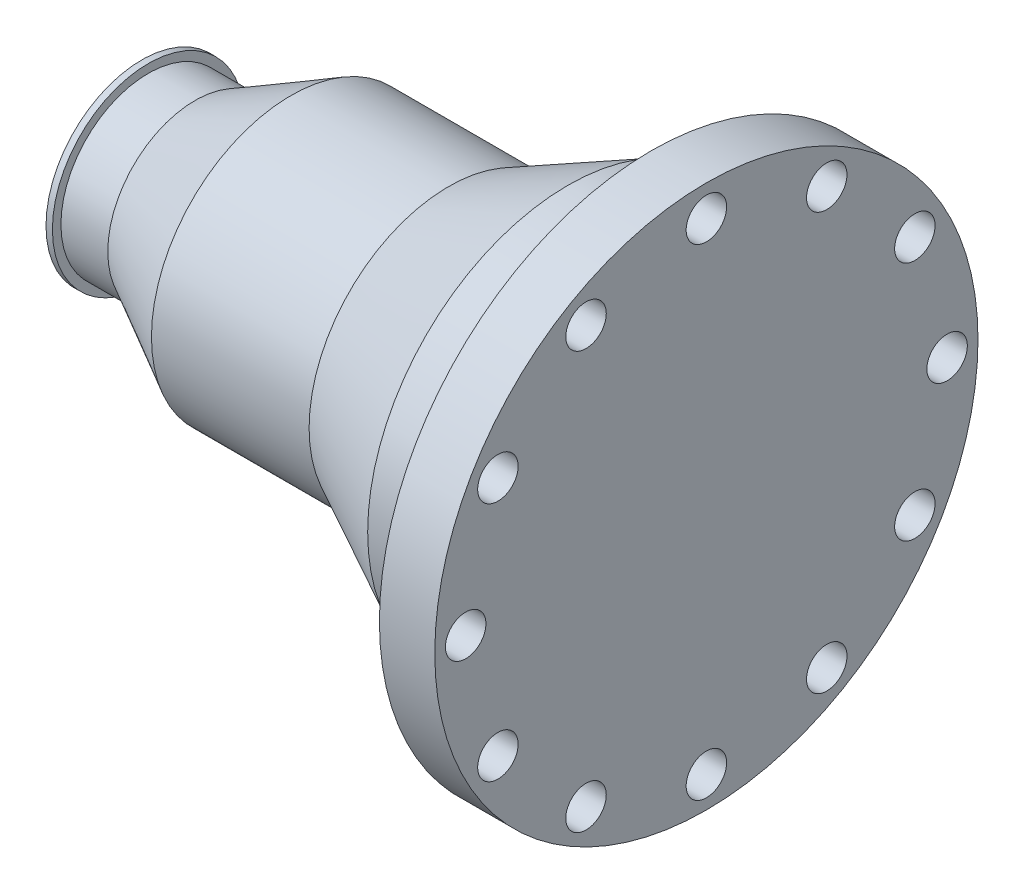
from build123d import *

# Parameters (mm, degrees)
SKETCH_3_R           = 9.5
CUT_EXTRUDE_1_DEPTH  = 321.526909947
SKETCH_4_R           = 9.5
CUT_EXTRUDE_2_DEPTH  = 321.526909947
SKETCH_5_R           = 9.5
CUT_EXTRUDE_3_DEPTH  = 321.526909947
SKETCH_6_R           = 9.5
CUT_EXTRUDE_4_DEPTH  = 321.526909947
SKETCH_7_R           = 9.5
CUT_EXTRUDE_5_DEPTH  = 321.526909947
SKETCH_8_R           = 9.5
CUT_EXTRUDE_6_DEPTH  = 321.526909947
SKETCH_9_R           = 9.5
CUT_EXTRUDE_7_DEPTH  = 321.526909947
SKETCH_10_R          = 9.5
CUT_EXTRUDE_8_DEPTH  = 321.526909947
SKETCH_11_R          = 9.5
CUT_EXTRUDE_9_DEPTH  = 321.526909947
SKETCH_12_R          = 9.5
CUT_EXTRUDE_10_DEPTH = 321.526909947
SKETCH_13_R          = 9.5
CUT_EXTRUDE_11_DEPTH = 321.526909947
SKETCH_14_R          = 9.5
CUT_EXTRUDE_12_DEPTH = 321.526909947


with BuildPart() as part:
    # Эскиз1 → Повернуть1 (revolve)
    with BuildSketch(Plane.XY, mode=Mode.PRIVATE) as revolve_1_sk:
        Polygon((0, 0), (265, 0), (265, 127.5), (239, 127.5), (239, 100), (239, 95), (220, 95), (220, 94), (200, 94), (144, 65.5), (70, 65.5), (25, 41), (3, 41), (3, 45), (0, 45), align=None)
    revolve(revolve_1_sk.sketch.rotate(Axis((0, 0, 0), (1, 0, 0)), 90), axis=Axis((0, 0, 0), (1, 0, 0)))

    # Эскиз2 → Вырез-Повернуть1 (revolve, cut)
    with BuildSketch(Plane.XY, mode=Mode.PRIVATE) as cut_revolve_1_sk:
        with BuildLine():
            Line((0, 0), (257, 0))
            Line((257, 0), (257, 34))
            Line((257, 34), (239, 34))
            Line((239, 34), (239, 47))
            Line((239, 47), (220, 47))
            Line((220, 47), (220, 38.502577))
            Line((220, 38.502577), (200, 38.502577))
            Line((200, 38.502577), (200, 55))
            Line((200, 55), (147.669872, 55))
            ThreePointArc((147.669872, 55), (146.273624348, 54.108499061), (146.669872, 52.5))
            Line((146.669872, 52.5), (143.5, 52.5))
            ThreePointArc((143.5, 52.5), (142.75, 52.602347572), (142, 52.5))
            Line((142, 52.5), (90, 52.5))
            ThreePointArc((90, 52.5), (79.13262933, 46.740617582), (70, 38.502577))
            Line((70, 38.502577), (42, 31))
            Line((42, 31), (0, 31))
            Line((0, 31), (0, 0))
        make_face()
    revolve(cut_revolve_1_sk.sketch.rotate(Axis((0, 0, 0), (1, 0, 0)), 90), axis=Axis((0, 0, 0), (1, 0, 0)), mode=Mode.SUBTRACT)

    # Эскиз3 → Вырез-Вытянуть1 (cut, through all)
    with BuildSketch(Plane(origin=(0, 0, 0), x_dir=(0, 0, -1), z_dir=(1, 0, 0))):
        with Locations((0, 113)):
            Circle(SKETCH_3_R)
    extrude(amount=CUT_EXTRUDE_1_DEPTH, mode=Mode.SUBTRACT)

    # Эскиз4 → Вырез-Вытянуть2 (cut, through all)
    with BuildSketch(Plane(origin=(0, 0, 0), x_dir=(0, 0, -1), z_dir=(1, 0, 0))):
        with Locations((-56.5, 97.860870628)):
            Circle(SKETCH_4_R)
    extrude(amount=CUT_EXTRUDE_2_DEPTH, mode=Mode.SUBTRACT)

    # Эскиз5 → Вырез-Вытянуть3 (cut, through all)
    with BuildSketch(Plane(origin=(0, 0, 0), x_dir=(0, 0, -1), z_dir=(1, 0, 0))):
        with Locations((-97.860870628, 56.5)):
            Circle(SKETCH_5_R)
    extrude(amount=CUT_EXTRUDE_3_DEPTH, mode=Mode.SUBTRACT)

    # Эскиз6 → Вырез-Вытянуть4 (cut, through all)
    with BuildSketch(Plane(origin=(0, 0, 0), x_dir=(0, 0, -1), z_dir=(1, 0, 0))):
        with Locations((-113, 0)):
            Circle(SKETCH_6_R)
    extrude(amount=CUT_EXTRUDE_4_DEPTH, mode=Mode.SUBTRACT)

    # Эскиз7 → Вырез-Вытянуть5 (cut, through all)
    with BuildSketch(Plane(origin=(0, 0, 0), x_dir=(0, 0, -1), z_dir=(1, 0, 0))):
        with Locations((-97.860870628, -56.5)):
            Circle(SKETCH_7_R)
    extrude(amount=CUT_EXTRUDE_5_DEPTH, mode=Mode.SUBTRACT)

    # Эскиз8 → Вырез-Вытянуть6 (cut, through all)
    with BuildSketch(Plane(origin=(0, 0, 0), x_dir=(0, 0, -1), z_dir=(1, 0, 0))):
        with Locations((-56.5, -97.860870628)):
            Circle(SKETCH_8_R)
    extrude(amount=CUT_EXTRUDE_6_DEPTH, mode=Mode.SUBTRACT)

    # Эскиз9 → Вырез-Вытянуть7 (cut, through all)
    with BuildSketch(Plane(origin=(0, 0, 0), x_dir=(0, 0, -1), z_dir=(1, 0, 0))):
        with Locations((0, -113)):
            Circle(SKETCH_9_R)
    extrude(amount=CUT_EXTRUDE_7_DEPTH, mode=Mode.SUBTRACT)

    # Эскиз10 → Вырез-Вытянуть8 (cut, through all)
    with BuildSketch(Plane(origin=(0, 0, 0), x_dir=(0, 0, -1), z_dir=(1, 0, 0))):
        with Locations((56.5, -97.860870628)):
            Circle(SKETCH_10_R)
    extrude(amount=CUT_EXTRUDE_8_DEPTH, mode=Mode.SUBTRACT)

    # Эскиз11 → Вырез-Вытянуть9 (cut, through all)
    with BuildSketch(Plane(origin=(0, 0, 0), x_dir=(0, 0, -1), z_dir=(1, 0, 0))):
        with Locations((97.860870628, -56.5)):
            Circle(SKETCH_11_R)
    extrude(amount=CUT_EXTRUDE_9_DEPTH, mode=Mode.SUBTRACT)

    # Эскиз12 → Вырез-Вытянуть10 (cut, through all)
    with BuildSketch(Plane(origin=(0, 0, 0), x_dir=(0, 0, -1), z_dir=(1, 0, 0))):
        with Locations((113, 0)):
            Circle(SKETCH_12_R)
    extrude(amount=CUT_EXTRUDE_10_DEPTH, mode=Mode.SUBTRACT)

    # Эскиз13 → Вырез-Вытянуть11 (cut, through all)
    with BuildSketch(Plane(origin=(0, 0, 0), x_dir=(0, 0, -1), z_dir=(1, 0, 0))):
        with Locations((97.860870628, 56.5)):
            Circle(SKETCH_13_R)
    extrude(amount=CUT_EXTRUDE_11_DEPTH, mode=Mode.SUBTRACT)

    # Эскиз14 → Вырез-Вытянуть12 (cut, through all)
    with BuildSketch(Plane(origin=(0, 0, 0), x_dir=(0, 0, -1), z_dir=(1, 0, 0))):
        with Locations((56.5, 97.860870628)):
            Circle(SKETCH_14_R)
    extrude(amount=CUT_EXTRUDE_12_DEPTH, mode=Mode.SUBTRACT)


solid = part.part
